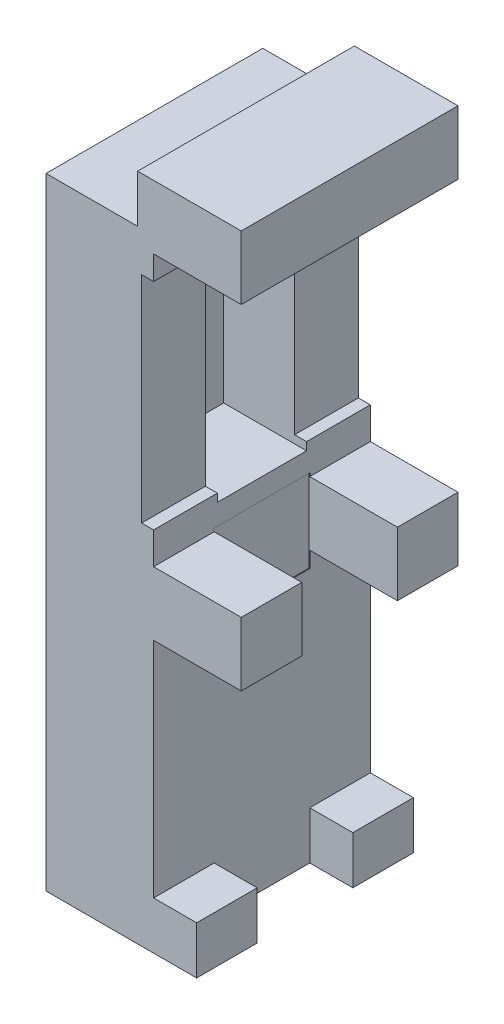
from build123d import *

# Parameters (mm, degrees)
GUIDE_AND_SOLID_STOPS_DEPTH  = 13.6
SKETCH_3_W                   = 8.4
SKETCH_3_H                   = 14
NUT_TONGUE_CHANNEL_DEPTH     = 2.8
SKETCH_4_W                   = 6.25
SKETCH_4_H                   = 5.2
LOWER_YOKE_RELIEF_DEPTH      = 3
SKETCH_5_W                   = 3.7
SKETCH_5_H                   = 3
LOWER_INWARD_STOP_DEPTH      = 3.8
SKETCH_7_W                   = 3.7
SKETCH_7_H                   = 3
EXTRUDE_2_DEPTH              = 3.8
REMOVE_LOWER_TAIL_DEPTH      = 62.002151601
REMOVE_LOWER_TAIL_DEPTH_BACK = 62.002151601
SKETCH_8_W                   = 17
SKETCH_8_H                   = 17


with BuildPart() as part:
    # 草图1 → Guide_and_solid_stops (new body)
    with BuildSketch(Plane.XY):
        Polygon((-10.2, 0), (-16.95, 0), (-16.95, 54), (-11.2, 54), (-11.2, 57), (-4.7, 57), (-4.7, 53), (-10.2, 53), (-10.2, 51.5), (-10.95, 51.5), (-10.95, 38), (-10.2, 38), (-10.2, 36), (-4.7, 36), (-4.7, 32), (-10.2, 32), align=None)
    extrude(amount=GUIDE_AND_SOLID_STOPS_DEPTH)

    # 草图3 → Nut_tongue_channel (cut, symmetric)
    with BuildSketch(Plane.XY.offset(6.8)):
        with Locations((-11.2, 44.5)):
            Rectangle(SKETCH_3_W, SKETCH_3_H)
    extrude(amount=NUT_TONGUE_CHANNEL_DEPTH, both=True, mode=Mode.SUBTRACT)

    # 草图4 → Lower_yoke_relief (cut, symmetric)
    with BuildSketch(Plane.XY.offset(6.8)):
        with Locations((-7.125, 33.6)):
            Rectangle(SKETCH_4_W, SKETCH_4_H)
    extrude(amount=LOWER_YOKE_RELIEF_DEPTH, both=True, mode=Mode.SUBTRACT)

    # 草图5 → Lower_inward_stop (add)
    with BuildSketch(Plane.XY):
        with Locations((-9.35, 16.5)):
            Rectangle(SKETCH_5_W, SKETCH_5_H)
    extrude(amount=LOWER_INWARD_STOP_DEPTH)

    # 草图7 → 凸台-拉伸2 (add)
    with BuildSketch(Plane.XY.offset(9.8)):
        with Locations((-9.35, 16.5)):
            Rectangle(SKETCH_7_W, SKETCH_7_H)
    extrude(amount=EXTRUDE_2_DEPTH)

    # 草图8 → Remove_lower_tail (cut, two sides: drawn at the far end of the back side and taken through both)
    with BuildSketch(Plane.XY.offset(-REMOVE_LOWER_TAIL_DEPTH_BACK)):
        with Locations((-11.5, 6.5)):
            Rectangle(SKETCH_8_W, SKETCH_8_H)
    extrude(amount=REMOVE_LOWER_TAIL_DEPTH + REMOVE_LOWER_TAIL_DEPTH_BACK, mode=Mode.SUBTRACT)


solid = part.part
